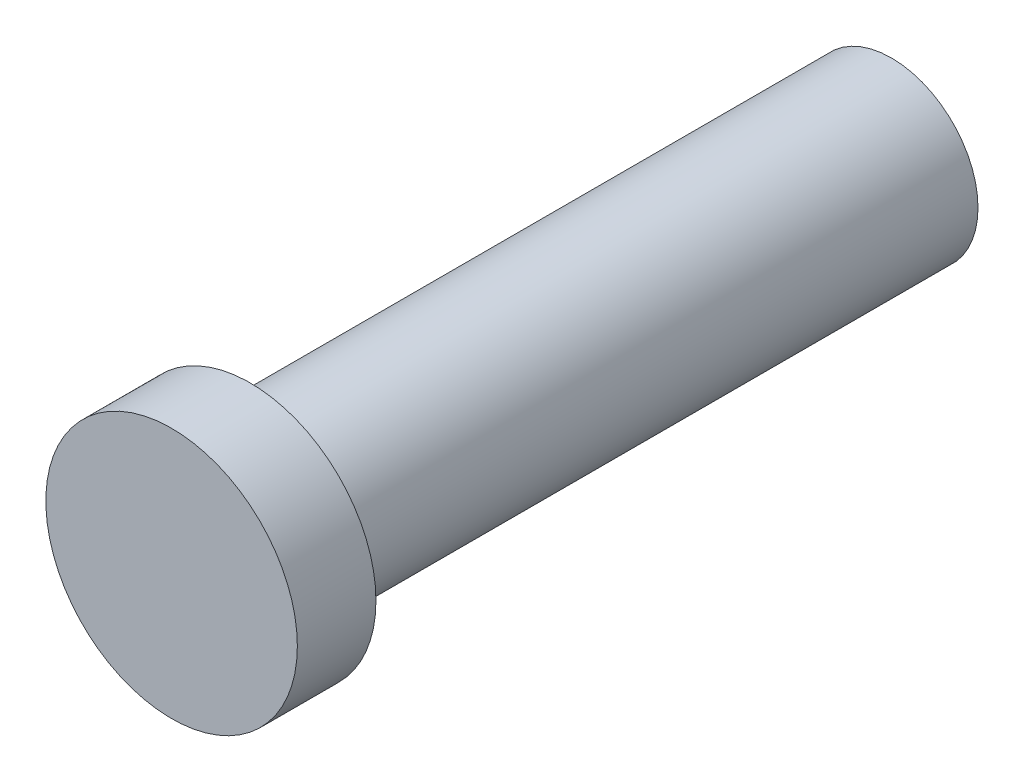
from build123d import *

# Parameters (mm, degrees)
SKETCH1_R           = 5.5
BOSS_EXTRUDE1_DEPTH = 40.8
SKETCH2_R           = 8
BOSS_EXTRUDE2_DEPTH = 5
SKETCH3_R           = 3.8
CUT_EXTRUDE1_DEPTH  = 40


with BuildPart() as part:
    # Sketch1 → Boss-Extrude1 (new body)
    with BuildSketch(Plane.XY):
        Circle(SKETCH1_R)
    extrude(amount=BOSS_EXTRUDE1_DEPTH)

    # Sketch2 → Boss-Extrude2 (add)
    with BuildSketch(Plane.XY.offset(40.8)):
        Circle(SKETCH2_R)
    extrude(amount=BOSS_EXTRUDE2_DEPTH)

    # Sketch3 → Cut-Extrude1 (cut)
    with BuildSketch(Plane(origin=(0, 0, 0), x_dir=(-1, 0, 0), z_dir=(0, 0, -1))):
        Circle(SKETCH3_R)
    extrude(amount=-CUT_EXTRUDE1_DEPTH, mode=Mode.SUBTRACT)


solid = part.part
